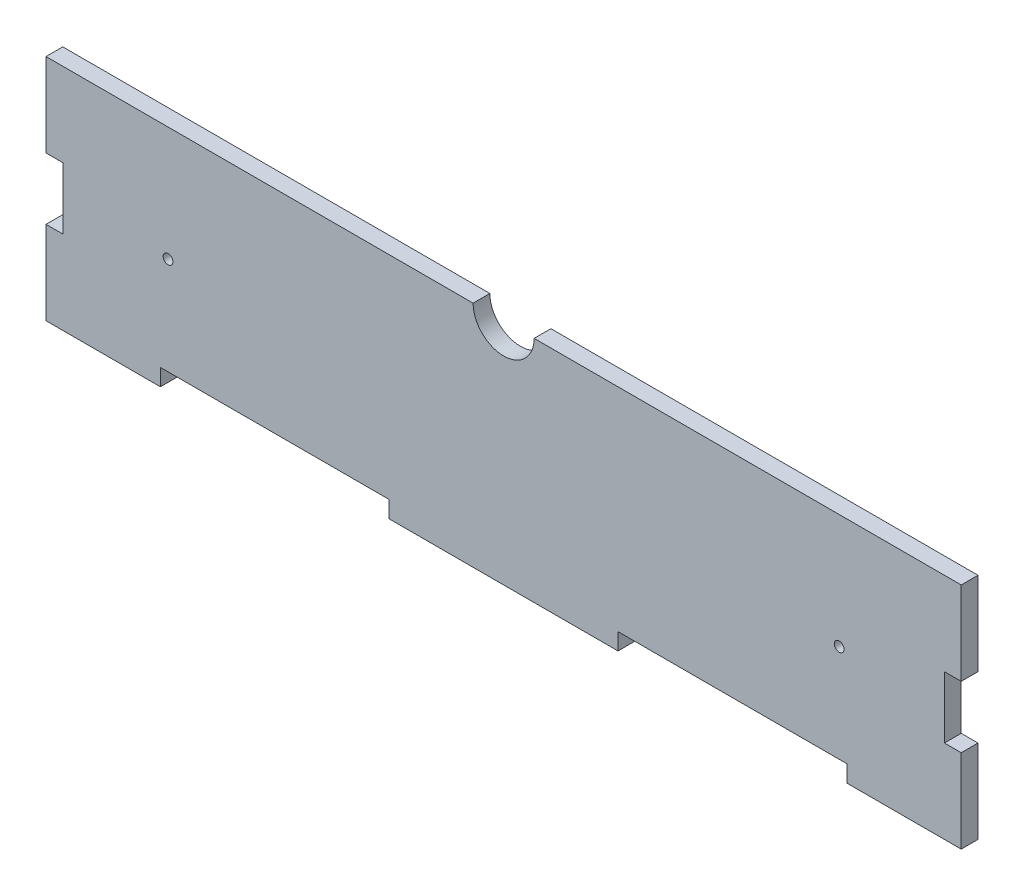
from build123d import *

# Parameters (mm, degrees)
BOSS_EXTRUDE1_DEPTH = 5.5
SKETCH2_R           = 10
CUT_EXTRUDE2_DEPTH  = 311.022983019
SKETCH3_R           = 1.6
CUT_EXTRUDE3_DEPTH  = 311.022983019
SKETCH4_W           = 9.45
SKETCH4_H           = 3.25
SKETCH4_W_2         = 2.65
SKETCH4_H_2         = 1.25
SKETCH4_W_3         = 3.25
SKETCH4_H_3         = 9.45
SKETCH4_H_4         = 2.65
SKETCH4_W_4         = 1.25
BOSS_EXTRUDE2_DEPTH = 5.5


with BuildPart() as part:
    # Sketch1 → Boss-Extrude1 (new body)
    with BuildSketch(Plane.XY):
        Polygon((0, 78), (0, 50.625), (5.5, 50.625), (5.5, 42.125), (14.95, 42.125), (14.95, 43.375), (17.6, 43.375), (17.6, 42.125), (20.25, 42.125), (20.25, 38.875), (17.6, 38.875), (17.6, 37.625), (14.95, 37.625), (14.95, 38.875), (5.5, 38.875), (5.5, 30.375), (0, 30.375), (0, 3), (37.5, 3), (37.5, 8.5), (73.375, 8.5), (73.375, 17.95), (72.125, 17.95), (72.125, 20.6), (73.375, 20.6), (73.375, 23.25), (76.625, 23.25), (76.625, 20.6), (77.875, 20.6), (77.875, 17.95), (76.625, 17.95), (76.625, 8.5), (112.5, 8.5), (112.5, 3), (187.5, 3), (187.5, 8.5), (223.375, 8.5), (223.375, 17.95), (222.125, 17.95), (222.125, 20.6), (223.375, 20.6), (223.375, 23.25), (226.625, 23.25), (226.625, 20.6), (227.875, 20.6), (227.875, 17.95), (226.625, 17.95), (226.625, 8.5), (262.5, 8.5), (262.5, 3), (300, 3), (300, 30.375), (294.5, 30.375), (294.5, 38.875), (285.05, 38.875), (285.05, 37.625), (282.4, 37.625), (282.4, 38.875), (279.75, 38.875), (279.75, 42.125), (282.4, 42.125), (282.4, 43.375), (285.05, 43.375), (285.05, 42.125), (294.5, 42.125), (294.5, 50.625), (300, 50.625), (300, 78), align=None)
    extrude(amount=BOSS_EXTRUDE1_DEPTH)

    # Sketch2 → Cut-Extrude2 (cut, through all)
    with BuildSketch(Plane.XY):
        with Locations((150, 78)):
            Circle(SKETCH2_R)
    extrude(amount=CUT_EXTRUDE2_DEPTH, mode=Mode.SUBTRACT)

    # Sketch3 → Cut-Extrude3 (cut, through all)
    with BuildSketch(Plane.XY.offset(5.5)):
        with Locations((40, 40.5)):
            Circle(SKETCH3_R)
        with Locations((260, 40.5)):
            Circle(SKETCH3_R)
    extrude(amount=-CUT_EXTRUDE3_DEPTH, mode=Mode.SUBTRACT)

    # Sketch4 → Boss-Extrude2 (add)
    with BuildSketch(Plane.XY.offset(5.5)):
        with Locations((289.775, 40.5)):
            Rectangle(SKETCH4_W, SKETCH4_H)
        with Locations((283.725, 40.5)):
            Rectangle(SKETCH4_W_2, SKETCH4_H)
        with Locations((281.075, 40.5)):
            Rectangle(SKETCH4_W_2, SKETCH4_H)
        with Locations((283.725, 38.25)):
            Rectangle(SKETCH4_W_2, SKETCH4_H_2)
        with Locations((283.725, 42.75)):
            Rectangle(SKETCH4_W_2, SKETCH4_H_2)
        with Locations((225, 13.225)):
            Rectangle(SKETCH4_W_3, SKETCH4_H_3)
        with Locations((225, 19.275)):
            Rectangle(SKETCH4_W_3, SKETCH4_H_4)
        with Locations((225, 21.925)):
            Rectangle(SKETCH4_W_3, SKETCH4_H_4)
        with Locations((227.25, 19.275)):
            Rectangle(SKETCH4_W_4, SKETCH4_H_4)
        with Locations((222.75, 19.275)):
            Rectangle(SKETCH4_W_4, SKETCH4_H_4)
        with Locations((75, 13.225)):
            Rectangle(SKETCH4_W_3, SKETCH4_H_3)
        with Locations((75, 19.275)):
            Rectangle(SKETCH4_W_3, SKETCH4_H_4)
        with Locations((75, 21.925)):
            Rectangle(SKETCH4_W_3, SKETCH4_H_4)
        with Locations((77.25, 19.275)):
            Rectangle(SKETCH4_W_4, SKETCH4_H_4)
        with Locations((72.75, 19.275)):
            Rectangle(SKETCH4_W_4, SKETCH4_H_4)
        with Locations((10.225, 40.5)):
            Rectangle(SKETCH4_W, SKETCH4_H)
        with Locations((16.275, 40.5)):
            Rectangle(SKETCH4_W_2, SKETCH4_H)
        with Locations((16.275, 38.25)):
            Rectangle(SKETCH4_W_2, SKETCH4_H_2)
        with Locations((18.925, 40.5)):
            Rectangle(SKETCH4_W_2, SKETCH4_H)
        with Locations((16.275, 42.75)):
            Rectangle(SKETCH4_W_2, SKETCH4_H_2)
    extrude(amount=-BOSS_EXTRUDE2_DEPTH)


solid = part.part
